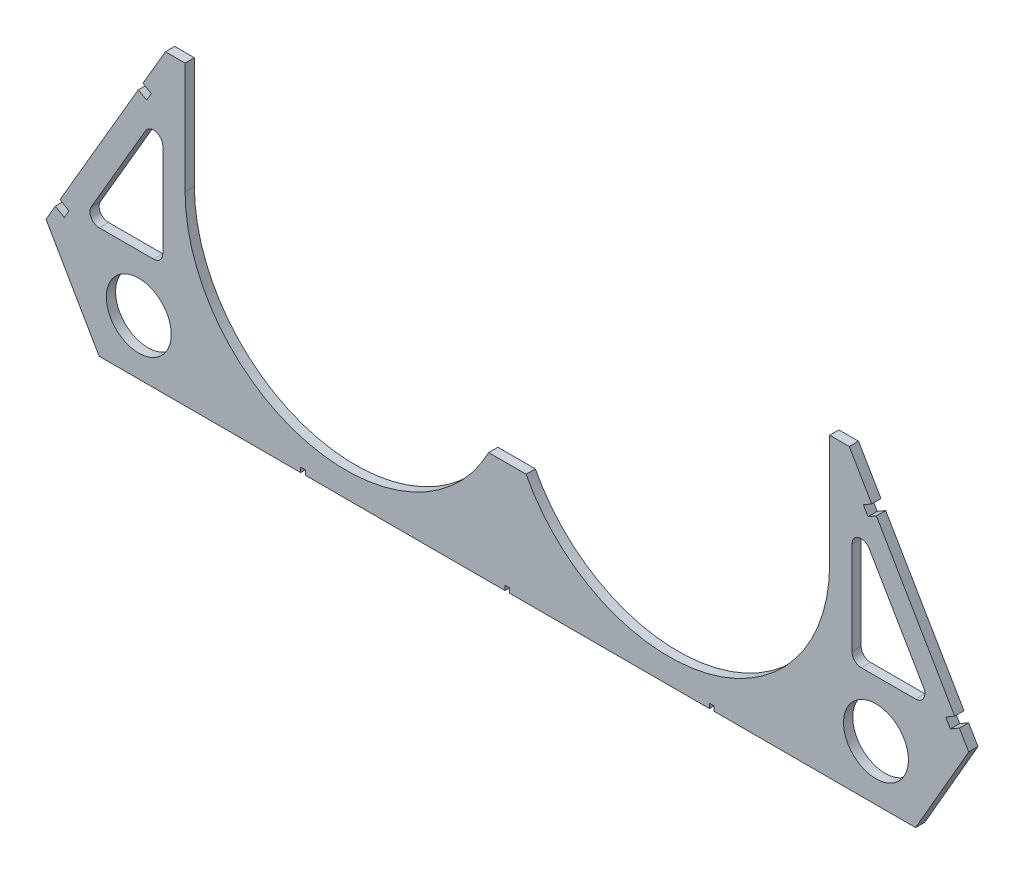
from build123d import *

# Parameters (mm, degrees)
BOSS_EXTRUDE1_DEPTH = 6.35
CUT_EXTRUDE3_REACH  = 377.568
SKETCH4_R           = 110.109
SKETCH9_R           = 22.225
CUT_EXTRUDE8_DEPTH  = 376.567629742
SKETCH11_W          = 3.175
SKETCH11_H          = 3.175
CUT_EXTRUDE10_DEPTH = 376.567629742
CUT_EXTRUDE12_DEPTH = 376.567629742
CUT_EXTRUDE15_DEPTH = 376.567629742
CUT_EXTRUDE18_DEPTH = 376.567629742


with BuildPart() as part:
    # Sketch1 → Boss-Extrude1 (new body)
    with BuildSketch(Plane.XY):
        Polygon((279.4, 0), (315.7855, 63.021534659), (234.035835214, 203.2), (-234.035835214, 203.2), (-315.7855, 63.021534659), (-279.4, 0), align=None)
    extrude(amount=BOSS_EXTRUDE1_DEPTH)

    # Sketch4 → Cut-Extrude3 (cut, up to next)
    with BuildSketch(Plane.XY.offset(6.35), mode=Mode.PRIVATE) as cut_extrude3_sk1:
        with Locations((110.49, 127)):
            Circle(SKETCH4_R)
    cut_extrude3_tool1 = extrude(cut_extrude3_sk1.sketch, amount=-CUT_EXTRUDE3_REACH, mode=Mode.PRIVATE) & part.part
    # Sketch4 → Cut-Extrude3 (cut, up to next)
    with BuildSketch(Plane.XY.offset(6.35), mode=Mode.PRIVATE) as cut_extrude3_sk2:
        with Locations((-110.49, 127)):
            Circle(SKETCH4_R)
    cut_extrude3_tool2 = extrude(cut_extrude3_sk2.sketch, amount=-CUT_EXTRUDE3_REACH, mode=Mode.PRIVATE) & part.part
    add(cut_extrude3_tool1.solids().sort_by_distance((110.49, 127, 6.35))[0], mode=Mode.SUBTRACT)
    add(cut_extrude3_tool2.solids().sort_by_distance((-110.49, 127, 6.35))[0], mode=Mode.SUBTRACT)

    # Sketch9 → Cut-Extrude8 (cut, through all)
    with BuildSketch(Plane.XY.offset(6.35)):
        with Locations((252.2855, 37.621534659)):
            Circle(SKETCH9_R)
        with Locations(Location((-252.2855, 37.621534659, 0), (0, 0, 180))):
            Circle(SKETCH9_R)
    extrude(amount=-CUT_EXTRUDE8_DEPTH, mode=Mode.SUBTRACT)

    # Sketch11 → Cut-Extrude10 (cut, through all)
    with BuildSketch(Plane.XY.offset(6.35)):
        with Locations((139.8905, 1.5875)):
            Rectangle(SKETCH11_W, SKETCH11_H)
        with Locations((0, 1.5875)):
            Rectangle(SKETCH11_W, SKETCH11_H)
        with Locations((-139.8905, 1.5875)):
            Rectangle(SKETCH11_W, SKETCH11_H)
    extrude(amount=-CUT_EXTRUDE10_DEPTH, mode=Mode.SUBTRACT)

    # Sketch13 → Cut-Extrude12 (cut, through all)
    with BuildSketch(Plane.XY.offset(6.35)):
        Polygon((-37.517518134, 76.2), (35.644230094, 76.2), (220.599, 127), (220.599, 203.2), (-220.599, 203.2), (-220.599, 127), align=None)
    extrude(amount=-CUT_EXTRUDE12_DEPTH, mode=Mode.SUBTRACT)

    # Sketch16 → Cut-Extrude15 (cut, through all)
    with BuildSketch(Plane(origin=(0, 0, 0), x_dir=(-1, 0, 0), z_dir=(0, 0, -1))):
        with BuildLine():
            Line((-247.674355458, 149.561981252), (-284.88900676, 85.748964754))
            ThreePointArc((-284.88900676, 85.748964754), (-284.909826298, 79.387005073), (-279.403651302, 76.2))
            Line((-279.403651302, 76.2), (-242.189, 76.2))
            ThreePointArc((-242.189, 76.2), (-237.698871939, 78.059871939), (-235.839, 82.55))
            Line((-235.839, 82.55), (-235.839, 146.363016498))
            ThreePointArc((-235.839, 146.363016498), (-240.532121483, 152.493045338), (-247.674355458, 149.561981252))
        make_face()
        with BuildLine():
            Line((242.189, 76.2), (279.403651302, 76.2))
            ThreePointArc((279.403651302, 76.2), (284.909826298, 79.387005073), (284.88900676, 85.748964754))
            Line((284.88900676, 85.748964754), (247.674355458, 149.561981252))
            ThreePointArc((247.674355458, 149.561981252), (240.532121483, 152.493045338), (235.839, 146.363016498))
            Line((235.839, 146.363016498), (235.839, 82.55))
            ThreePointArc((235.839, 82.55), (237.698871939, 78.059871939), (242.189, 76.2))
        make_face()
    extrude(amount=-CUT_EXTRUDE15_DEPTH, mode=Mode.SUBTRACT)

    # Sketch19 → Cut-Extrude18 (cut, through all)
    with BuildSketch(Plane(origin=(0, 0, 0), x_dir=(-1, 0, 0), z_dir=(0, 0, -1))):
        Polygon((-306.188605737, 79.477601033), (-309.387570492, 73.992245575), (-303.243972379, 70.40940505), (-300.045007624, 75.894760508), align=None)
        Polygon((-253.014789274, 171.632766807), (-246.871191161, 168.049926283), (-243.672226407, 173.535281741), (-249.81582452, 177.118122266), align=None)
        Polygon((249.81582452, 177.118122266), (253.014789274, 171.632766807), (246.871191161, 168.049926283), (243.672226407, 173.535281741), align=None)
        Polygon((300.045007624, 75.894760508), (306.188605737, 79.477601033), (309.387570492, 73.992245575), (303.243972379, 70.40940505), align=None)
    extrude(amount=-CUT_EXTRUDE18_DEPTH, mode=Mode.SUBTRACT)


solid = part.part
